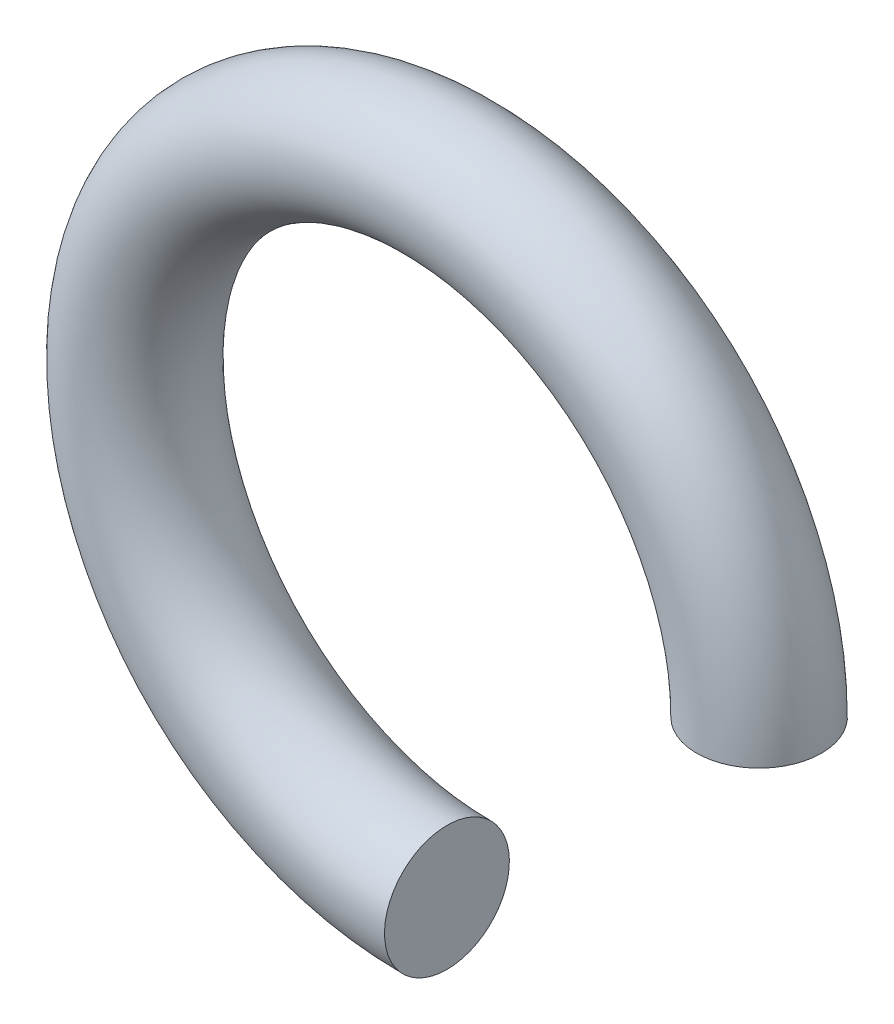
from build123d import *

# Parameters (mm, degrees)
SKETCH_PROFILE_R    = 4
FEATURE_TORUS_ANGLE = 270


with BuildPart() as part:
    # sketch:profile → feature:torus (revolve)
    with BuildSketch(Plane.XZ):
        with Locations((20, 0)):
            Circle(SKETCH_PROFILE_R)
    revolve(axis=Axis((0, 0, -15), (0, 0, 1)), revolution_arc=FEATURE_TORUS_ANGLE)


solid = part.part
